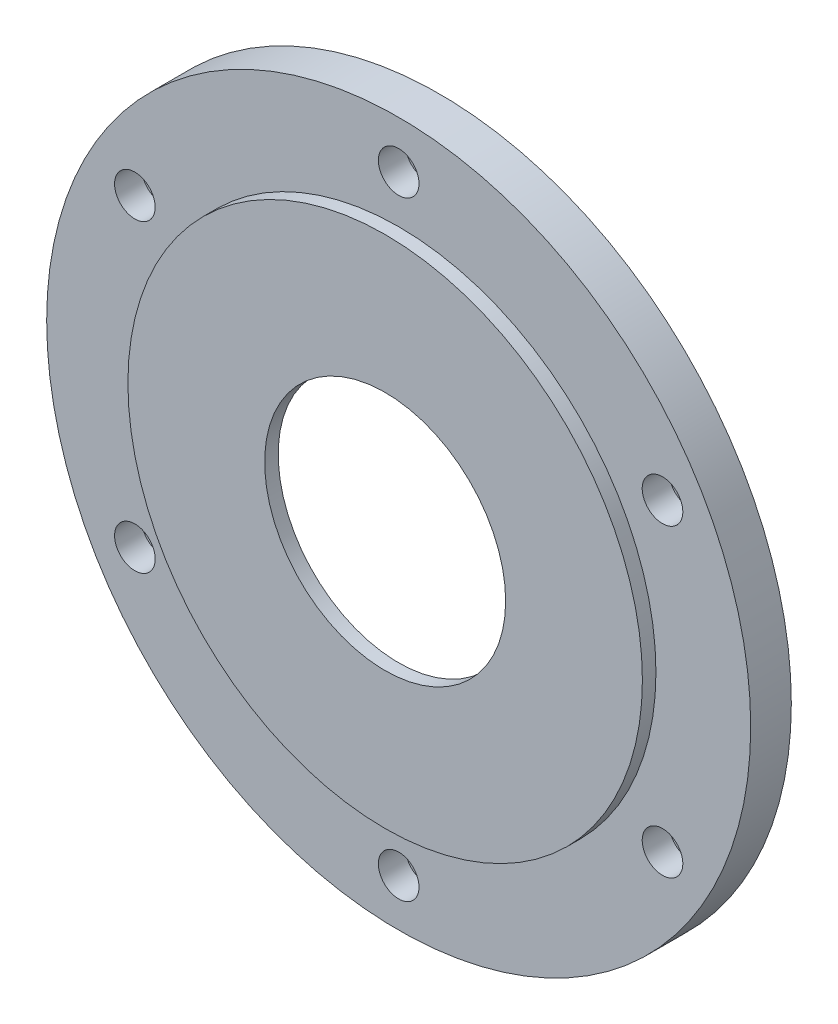
from build123d import *

# Parameters (mm, degrees)
CROQUIS1_R              = 19
CROQUIS1_R_2            = 8.9
SALIENTE_EXTRUIR1_DEPTH = 1
CROQUIS2_R              = 26
CROQUIS2_R_2            = 19
SALIENTE_EXTRUIR2_DEPTH = 3
CROQUIS3_R              = 1.5
CORTAR_EXTRUIR1_DEPTH   = 2


with BuildPart() as part:
    # Croquis1 → Saliente-Extruir1 (new body)
    with BuildSketch(Plane.XY):
        Circle(CROQUIS1_R)
        Circle(CROQUIS1_R_2, mode=Mode.SUBTRACT)
    extrude(amount=SALIENTE_EXTRUIR1_DEPTH)


with BuildPart() as body_2:
    # Croquis2 → Saliente-Extruir2 (new body)
    with BuildSketch(Plane(origin=(0, 0, 0), x_dir=(-1, 0, 0), z_dir=(0, 0, -1))):
        Circle(CROQUIS2_R)
        Circle(CROQUIS2_R_2, mode=Mode.SUBTRACT)
    extrude(amount=SALIENTE_EXTRUIR2_DEPTH)

    # Croquis3 → Cortar-Extruir1 (cut)
    with BuildSketch(Plane.XY):
        with Locations((0, 22.5)):
            Circle(CROQUIS3_R)
        with Locations((19.485571585, 11.25)):
            Circle(CROQUIS3_R)
        with Locations((19.485571585, -11.25)):
            Circle(CROQUIS3_R)
        with Locations((0, -22.5)):
            Circle(CROQUIS3_R)
        with Locations((-19.485571585, -11.25)):
            Circle(CROQUIS3_R)
        with Locations((-19.485571585, 11.25)):
            Circle(CROQUIS3_R)
    extrude(amount=-CORTAR_EXTRUIR1_DEPTH, mode=Mode.SUBTRACT)


solid = Compound([part.part, body_2.part])
